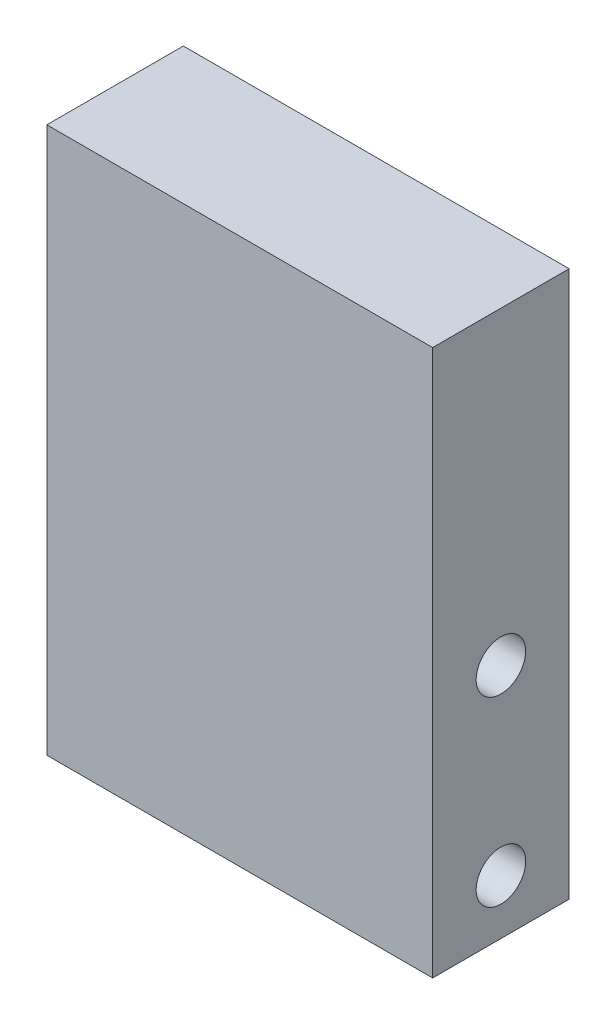
from build123d import *

# Parameters (mm, degrees)
SKETCH1_W             = 26.924
SKETCH1_H             = 38.1
BOSS_EXTRUDE1_DEPTH   = 4.7625
F_8_32_TAPPED_HOLE1_D = 3.4544


with BuildPart() as part:
    # Sketch1 → Boss-Extrude1 (new, symmetric)
    with BuildSketch(Plane.XY):
        Rectangle(SKETCH1_W, SKETCH1_H)
    extrude(amount=BOSS_EXTRUDE1_DEPTH, both=True)

    # #8-32 Tapped Hole1 (through all)
    with Locations(Plane(origin=(13.462, 0, 0), x_dir=(0, 0, -1), z_dir=(1, 0, 0))):
        with Locations((0, -15.24), (0, -2.54)):
            Hole(F_8_32_TAPPED_HOLE1_D / 2)


solid = part.part
